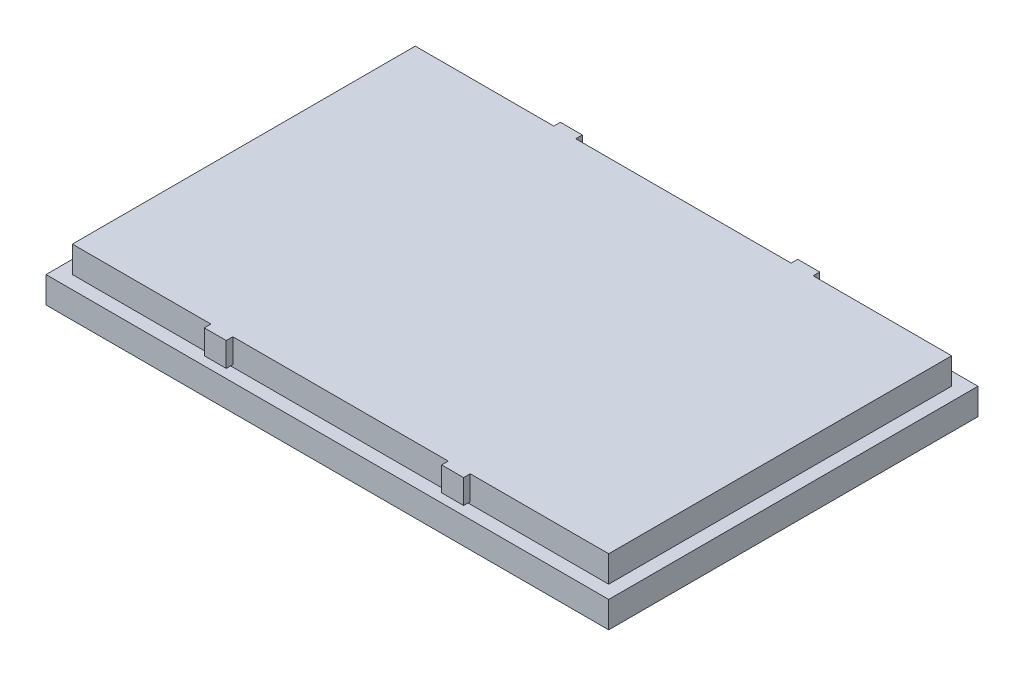
from build123d import *

# Parameters (mm, degrees)
BOSS_EXTRUDE1_START = -72.4
SKETCH1_W           = 25.6
SKETCH1_H           = 1.2
BOSS_EXTRUDE1_DEPTH = 16.8
BOSS_EXTRUDE2_START = -71.8
SKETCH2_W           = 24.4
SKETCH2_H           = 1.21
BOSS_EXTRUDE2_DEPTH = 15.6
BOSS_EXTRUDE3_START = -72.1
SKETCH3_W           = 1
SKETCH3_H           = 1.1
BOSS_EXTRUDE3_DEPTH = 0.31
BOSS_EXTRUDE4_START = -56.21
SKETCH4_W           = 1
SKETCH4_H           = 1.1
BOSS_EXTRUDE4_DEPTH = 0.31
BOSS_EXTRUDE5_START = -72.1
SKETCH5_W           = 1
SKETCH5_H           = 1.1
BOSS_EXTRUDE5_DEPTH = 0.31
BOSS_EXTRUDE6_START = -56.21
SKETCH6_W           = 1
SKETCH6_H           = 1.1
BOSS_EXTRUDE6_DEPTH = 0.31
BOSS_EXTRUDE7_START = -72.5
SKETCH7_W           = 3
SKETCH7_H           = 0.7
BOSS_EXTRUDE7_DEPTH = 0.9


with BuildPart() as part:
    # Sketch1 → Boss-Extrude1 (new body)
    with BuildSketch(Plane.XY.offset(BOSS_EXTRUDE1_START)):
        with Locations((-26.8, 0.6)):
            Rectangle(SKETCH1_W, SKETCH1_H)
    extrude(amount=BOSS_EXTRUDE1_DEPTH)

    # Sketch2 → Boss-Extrude2 (add)
    with BuildSketch(Plane.XY.offset(BOSS_EXTRUDE2_START)):
        with Locations((-26.8, 1.795)):
            Rectangle(SKETCH2_W, SKETCH2_H)
    extrude(amount=BOSS_EXTRUDE2_DEPTH)

    # Sketch3 → Boss-Extrude3 (add)
    with BuildSketch(Plane.XY.offset(BOSS_EXTRUDE3_START)):
        with Locations((-21.4, 1.85)):
            Rectangle(SKETCH3_W, SKETCH3_H)
    extrude(amount=BOSS_EXTRUDE3_DEPTH)

    # Sketch4 → Boss-Extrude4 (add)
    with BuildSketch(Plane.XY.offset(BOSS_EXTRUDE4_START)):
        with Locations((-21.4, 1.85)):
            Rectangle(SKETCH4_W, SKETCH4_H)
    extrude(amount=BOSS_EXTRUDE4_DEPTH)

    # Sketch5 → Boss-Extrude5 (add)
    with BuildSketch(Plane.XY.offset(BOSS_EXTRUDE5_START)):
        with Locations((-32.2, 1.85)):
            Rectangle(SKETCH5_W, SKETCH5_H)
    extrude(amount=BOSS_EXTRUDE5_DEPTH)

    # Sketch6 → Boss-Extrude6 (add)
    with BuildSketch(Plane.XY.offset(BOSS_EXTRUDE6_START)):
        with Locations((-32.2, 1.85)):
            Rectangle(SKETCH6_W, SKETCH6_H)
    extrude(amount=BOSS_EXTRUDE6_DEPTH)


with BuildPart() as body_2:
    # Sketch7 → Boss-Extrude7 (new body)
    with BuildSketch(Plane.XY.offset(BOSS_EXTRUDE7_START)):
        with Locations((-26.8, 0.25)):
            Rectangle(SKETCH7_W, SKETCH7_H)
    extrude(amount=BOSS_EXTRUDE7_DEPTH)


with BuildPart() as part_1:
    add(part.part)

    # Combine1: cut body 2
    add(body_2.part, mode=Mode.SUBTRACT)


solid = part_1.part
